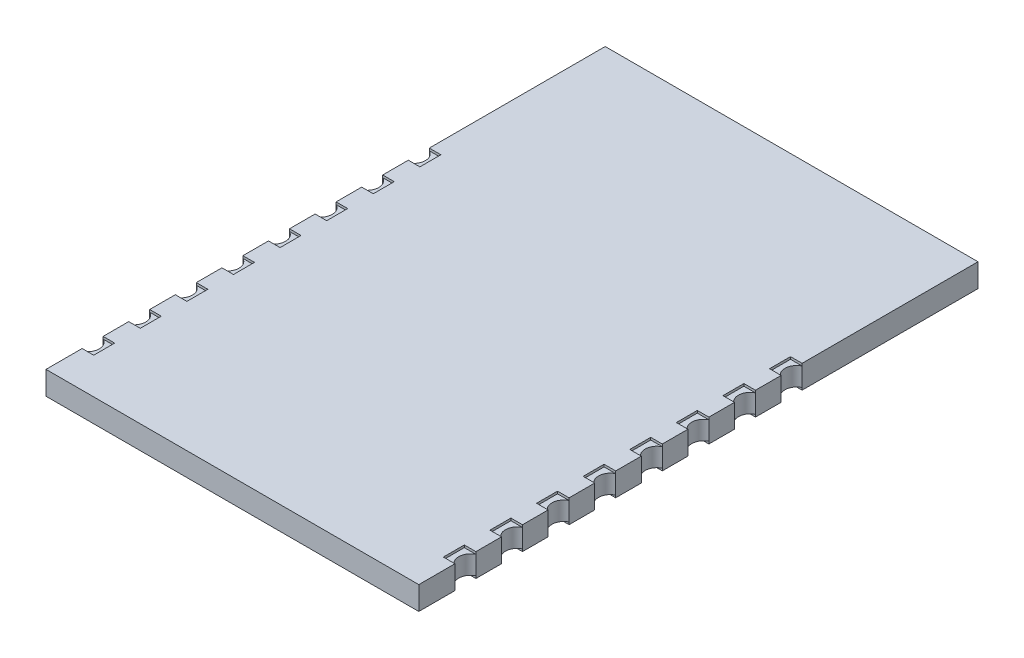
from build123d import *

# Parameters (mm, degrees)
SKETCH_1_W          = 16
SKETCH_1_H          = 24
EXTRUDE_1_DEPTH     = 1
SKETCH_2_W          = 0.497014283
SKETCH_2_H          = 0.9
SKETCH_2_W_2        = 0.5
CUT_EXTRUDE_1_DEPTH = 0.1
SKETCH_3_W          = 1
SKETCH_3_H          = 0.9
CUT_EXTRUDE_2_DEPTH = 0.1
SKETCH_8_W          = 4.7
SKETCH_8_H          = 4.7
CUT_EXTRUDE_3_DEPTH = 0.1
SKETCH_12_R         = 0.2
CUT_EXTRUDE_4_DEPTH = 0.1
SKETCH_13_W         = 4.7
SKETCH_13_H         = 4.7
EXTRUDE_2_DEPTH     = 0.5
SKETCH_15_W         = 4.7
SKETCH_15_H         = 4.7
CUT_EXTRUDE_5_DEPTH = 0.1
SKETCH_16_R         = 0.2
CUT_EXTRUDE_6_DEPTH = 0.25
CUT_EXTRUDE_7_DEPTH = 10


with BuildPart() as part:
    # 草圖1 → 填料-伸長1 (new body)
    with BuildSketch(Plane(origin=(0, 0, 0), x_dir=(1, 0, 0), z_dir=(0, 1, 0))):
        Rectangle(SKETCH_1_W, SKETCH_1_H)
    extrude(amount=EXTRUDE_1_DEPTH)

    # 草圖2 → 除料-伸長1 (cut)
    with BuildSketch(Plane(origin=(0, 1, 0), x_dir=(1, 0, 0), z_dir=(0, 1, 0))):
        with Locations((-7.751492859, 1.999997771)):
            Rectangle(SKETCH_2_W, SKETCH_2_H)
        with Locations((-7.751492859, -2.229e-06)):
            Rectangle(SKETCH_2_W, SKETCH_2_H)
        with Locations((-7.751492859, -2.000002229)):
            Rectangle(SKETCH_2_W, SKETCH_2_H)
        with Locations((-7.751492859, -4.000002229)):
            Rectangle(SKETCH_2_W, SKETCH_2_H)
        with Locations((-7.751492859, -6.000002229)):
            Rectangle(SKETCH_2_W, SKETCH_2_H)
        with Locations((-7.751492859, -8.000002229)):
            Rectangle(SKETCH_2_W, SKETCH_2_H)
        with Locations((-7.751492859, -10.000002229)):
            Rectangle(SKETCH_2_W, SKETCH_2_H)
        with Locations((7.751492859, -10.000002229)):
            Rectangle(SKETCH_2_W, SKETCH_2_H)
        with Locations((7.751492859, -8.000002229)):
            Rectangle(SKETCH_2_W, SKETCH_2_H)
        with Locations((7.751492859, -6.000002229)):
            Rectangle(SKETCH_2_W, SKETCH_2_H)
        with Locations((7.751492859, -4.000002229)):
            Rectangle(SKETCH_2_W, SKETCH_2_H)
        with Locations((7.751492859, -2.000002229)):
            Rectangle(SKETCH_2_W, SKETCH_2_H)
        with Locations((7.751492859, -2.229e-06)):
            Rectangle(SKETCH_2_W, SKETCH_2_H)
        with Locations((7.751492859, 3.999997771)):
            Rectangle(SKETCH_2_W, SKETCH_2_H)
        with Locations((7.751492859, 1.999997771)):
            Rectangle(SKETCH_2_W, SKETCH_2_H)
        with Locations((-7.752985717, 3.999997771)):
            Rectangle(SKETCH_2_W_2, SKETCH_2_H)
    extrude(amount=-CUT_EXTRUDE_1_DEPTH, mode=Mode.SUBTRACT)

    # 草圖3 → 除料-伸長2 (cut)
    with BuildSketch(Plane.XZ):
        with Locations((7.5, 8)):
            Rectangle(SKETCH_3_W, SKETCH_3_H)
        with Locations((7.5, 10)):
            Rectangle(SKETCH_3_W, SKETCH_3_H)
        with Locations((7.5, 6)):
            Rectangle(SKETCH_3_W, SKETCH_3_H)
        with Locations((7.5, 4)):
            Rectangle(SKETCH_3_W, SKETCH_3_H)
        with Locations((7.5, 2)):
            Rectangle(SKETCH_3_W, SKETCH_3_H)
        with Locations((7.5, 0)):
            Rectangle(SKETCH_3_W, SKETCH_3_H)
        with Locations((7.5, -2)):
            Rectangle(SKETCH_3_W, SKETCH_3_H)
        with Locations((7.5, -4)):
            Rectangle(SKETCH_3_W, SKETCH_3_H)
        with Locations((-7.5, 10)):
            Rectangle(SKETCH_3_W, SKETCH_3_H)
        with Locations((-7.5, -4)):
            Rectangle(SKETCH_3_W, SKETCH_3_H)
        with Locations((-7.5, -2)):
            Rectangle(SKETCH_3_W, SKETCH_3_H)
        with Locations((-7.5, 0)):
            Rectangle(SKETCH_3_W, SKETCH_3_H)
        with Locations((-7.5, 2)):
            Rectangle(SKETCH_3_W, SKETCH_3_H)
        with Locations((-7.5, 4)):
            Rectangle(SKETCH_3_W, SKETCH_3_H)
        with Locations((-7.5, 6)):
            Rectangle(SKETCH_3_W, SKETCH_3_H)
        with Locations((-7.5, 8)):
            Rectangle(SKETCH_3_W, SKETCH_3_H)
    extrude(amount=-CUT_EXTRUDE_2_DEPTH, mode=Mode.SUBTRACT)

    # 草圖8 → 除料-伸長3 (cut)
    with BuildSketch(Plane(origin=(0, 1, 0), x_dir=(1, 0, 0), z_dir=(0, 1, 0))):
        with Locations((1.35, -1.75)):
            Rectangle(SKETCH_8_W, SKETCH_8_H)
    extrude(amount=-CUT_EXTRUDE_3_DEPTH, mode=Mode.SUBTRACT)

    # 草圖12 → 除料-伸長4 (cut)
    with BuildSketch(Plane(origin=(0, 0.9, 0), x_dir=(1, 0, 0), z_dir=(0, 1, 0))):
        with Locations(Location((-0.51, -3.65, 0), (0, 0, 270))):
            Circle(SKETCH_12_R)
        with Locations(Location((0.42, -3.65, 0), (0, 0, 270))):
            Circle(SKETCH_12_R)
        with Locations(Location((1.35, -3.65, 0), (0, 0, 270))):
            Circle(SKETCH_12_R)
        with Locations(Location((2.28, -3.65, 0), (0, 0, 270))):
            Circle(SKETCH_12_R)
        with Locations(Location((3.21, -3.65, 0), (0, 0, 270))):
            Circle(SKETCH_12_R)
        with Locations(Location((-0.51, -2.72, 0), (0, 0, 270))):
            Circle(SKETCH_12_R)
        with Locations(Location((0.42, -2.72, 0), (0, 0, 270))):
            Circle(SKETCH_12_R)
        with Locations(Location((1.35, -2.72, 0), (0, 0, 270))):
            Circle(SKETCH_12_R)
        with Locations(Location((2.28, -2.72, 0), (0, 0, 270))):
            Circle(SKETCH_12_R)
        with Locations(Location((3.21, -2.72, 0), (0, 0, 270))):
            Circle(SKETCH_12_R)
        with Locations(Location((-0.51, -1.79, 0), (0, 0, 270))):
            Circle(SKETCH_12_R)
        with Locations(Location((0.42, -1.79, 0), (0, 0, 270))):
            Circle(SKETCH_12_R)
        with Locations(Location((1.35, -1.79, 0), (0, 0, 270))):
            Circle(SKETCH_12_R)
        with Locations(Location((2.28, -1.79, 0), (0, 0, 270))):
            Circle(SKETCH_12_R)
        with Locations(Location((3.21, -1.79, 0), (0, 0, 270))):
            Circle(SKETCH_12_R)
        with Locations(Location((-0.51, -0.86, 0), (0, 0, 270))):
            Circle(SKETCH_12_R)
        with Locations(Location((0.42, -0.86, 0), (0, 0, 270))):
            Circle(SKETCH_12_R)
        with Locations(Location((1.35, -0.86, 0), (0, 0, 270))):
            Circle(SKETCH_12_R)
        with Locations(Location((2.28, -0.86, 0), (0, 0, 270))):
            Circle(SKETCH_12_R)
        with Locations(Location((3.21, -0.86, 0), (0, 0, 270))):
            Circle(SKETCH_12_R)
        with Locations(Location((-0.51, 0.07, 0), (0, 0, 270))):
            Circle(SKETCH_12_R)
        with Locations(Location((0.42, 0.07, 0), (0, 0, 270))):
            Circle(SKETCH_12_R)
        with Locations(Location((1.35, 0.07, 0), (0, 0, 270))):
            Circle(SKETCH_12_R)
        with Locations(Location((2.28, 0.07, 0), (0, 0, 270))):
            Circle(SKETCH_12_R)
        with Locations(Location((3.21, 0.07, 0), (0, 0, 270))):
            Circle(SKETCH_12_R)
    extrude(amount=-CUT_EXTRUDE_4_DEPTH, mode=Mode.SUBTRACT)

    # 草圖13 → 填料-伸長2 (add)
    with BuildSketch(Plane(origin=(0, 1, 0), x_dir=(1, 0, 0), z_dir=(0, 1, 0))):
        with Locations((1.35, -1.75)):
            Rectangle(SKETCH_13_W, SKETCH_13_H)
    extrude(amount=-EXTRUDE_2_DEPTH)

    # 草圖15 → 除料-伸長5 (cut)
    with BuildSketch(Plane.XZ):
        with Locations((-1.35, 1.75)):
            Rectangle(SKETCH_15_W, SKETCH_15_H)
    extrude(amount=-CUT_EXTRUDE_5_DEPTH, mode=Mode.SUBTRACT)

    # 草圖16 → 除料-伸長6 (cut)
    with BuildSketch(Plane.XZ):
        with Locations(Location((0.51, 3.61, 0), (0, 0, 270))):
            Circle(SKETCH_16_R)
        with Locations(Location((-0.42, 3.61, 0), (0, 0, 270))):
            Circle(SKETCH_16_R)
        with Locations(Location((-1.35, 3.61, 0), (0, 0, 270))):
            Circle(SKETCH_16_R)
        with Locations(Location((-2.28, 3.61, 0), (0, 0, 270))):
            Circle(SKETCH_16_R)
        with Locations(Location((-3.21, 3.61, 0), (0, 0, 270))):
            Circle(SKETCH_16_R)
        with Locations(Location((-3.21, 2.68, 0), (0, 0, 270))):
            Circle(SKETCH_16_R)
        with Locations(Location((-2.28, 2.68, 0), (0, 0, 270))):
            Circle(SKETCH_16_R)
        with Locations(Location((-1.35, 2.68, 0), (0, 0, 270))):
            Circle(SKETCH_16_R)
        with Locations(Location((-0.42, 2.68, 0), (0, 0, 270))):
            Circle(SKETCH_16_R)
        with Locations(Location((0.51, 2.68, 0), (0, 0, 270))):
            Circle(SKETCH_16_R)
        with Locations(Location((-3.21, 1.75, 0), (0, 0, 270))):
            Circle(SKETCH_16_R)
        with Locations(Location((-2.28, 1.75, 0), (0, 0, 270))):
            Circle(SKETCH_16_R)
        with Locations(Location((-1.35, 1.75, 0), (0, 0, 270))):
            Circle(SKETCH_16_R)
        with Locations(Location((-0.42, 1.75, 0), (0, 0, 270))):
            Circle(SKETCH_16_R)
        with Locations(Location((0.51, 1.75, 0), (0, 0, 270))):
            Circle(SKETCH_16_R)
        with Locations(Location((-3.21, 0.82, 0), (0, 0, 270))):
            Circle(SKETCH_16_R)
        with Locations(Location((-2.28, 0.82, 0), (0, 0, 270))):
            Circle(SKETCH_16_R)
        with Locations(Location((-1.35, 0.82, 0), (0, 0, 270))):
            Circle(SKETCH_16_R)
        with Locations(Location((-0.42, 0.82, 0), (0, 0, 270))):
            Circle(SKETCH_16_R)
        with Locations(Location((0.51, 0.82, 0), (0, 0, 270))):
            Circle(SKETCH_16_R)
        with Locations(Location((-3.21, -0.11, 0), (0, 0, 270))):
            Circle(SKETCH_16_R)
        with Locations(Location((-2.28, -0.11, 0), (0, 0, 270))):
            Circle(SKETCH_16_R)
        with Locations(Location((-1.35, -0.11, 0), (0, 0, 270))):
            Circle(SKETCH_16_R)
        with Locations(Location((-0.42, -0.11, 0), (0, 0, 270))):
            Circle(SKETCH_16_R)
        with Locations(Location((0.51, -0.11, 0), (0, 0, 270))):
            Circle(SKETCH_16_R)
    extrude(amount=-CUT_EXTRUDE_6_DEPTH, mode=Mode.SUBTRACT)

    # 草圖17 → 除料-伸長7 (cut)
    with BuildSketch(Plane(origin=(0, 1, 0), x_dir=(1, 0, 0), z_dir=(0, 1, 0))):
        with BuildLine():
            Line((-8, 4.449997771), (-8, 3.549997771))
            ThreePointArc((-8, 3.549997771), (-7.717944947, 3.999997771), (-8, 4.449997771))
        make_face()
        with BuildLine():
            Line((-8, 2.449997771), (-8, 1.549997771))
            ThreePointArc((-8, 1.549997771), (-7.717944947, 1.999997771), (-8, 2.449997771))
        make_face()
        with BuildLine():
            Line((-8, 0.449997771), (-8, -0.450002229))
            ThreePointArc((-8, -0.450002229), (-7.717944947, -2.229e-06), (-8, 0.449997771))
        make_face()
        with BuildLine():
            Line((-8, -1.550002229), (-8, -2.450002229))
            ThreePointArc((-8, -2.450002229), (-7.717944947, -2.000002229), (-8, -1.550002229))
        make_face()
        with BuildLine():
            Line((-8, -3.550002229), (-8, -4.450002229))
            ThreePointArc((-8, -4.450002229), (-7.717944947, -4.000002229), (-8, -3.550002229))
        make_face()
        with BuildLine():
            Line((-8, -5.550002229), (-8, -6.450002229))
            ThreePointArc((-8, -6.450002229), (-7.717944947, -6.000002229), (-8, -5.550002229))
        make_face()
        with BuildLine():
            Line((-8, -7.550002229), (-8, -8.450002229))
            ThreePointArc((-8, -8.450002229), (-7.717944947, -8.000002229), (-8, -7.550002229))
        make_face()
        with BuildLine():
            Line((-8, -9.550002229), (-8, -10.450002229))
            ThreePointArc((-8, -10.450002229), (-7.717944947, -10.000002229), (-8, -9.550002229))
        make_face()
        with BuildLine():
            Line((8, -9.550002229), (8, -10.450002229))
            ThreePointArc((8, -10.450002229), (7.717944947, -10.000002229), (8, -9.550002229))
        make_face()
        with BuildLine():
            Line((8, -7.550002229), (8, -8.450002229))
            ThreePointArc((8, -8.450002229), (7.717944947, -8.000002229), (8, -7.550002229))
        make_face()
        with BuildLine():
            Line((8, -5.550002229), (8, -6.450002229))
            ThreePointArc((8, -6.450002229), (7.717944947, -6.000002229), (8, -5.550002229))
        make_face()
        with BuildLine():
            Line((8, -3.550002229), (8, -4.450002229))
            ThreePointArc((8, -4.450002229), (7.717944947, -4.000002229), (8, -3.550002229))
        make_face()
        with BuildLine():
            Line((8, -1.550002229), (8, -2.450002229))
            ThreePointArc((8, -2.450002229), (7.717944947, -2.000002229), (8, -1.550002229))
        make_face()
        with BuildLine():
            Line((8, 0.449997771), (8, -0.450002229))
            ThreePointArc((8, -0.450002229), (7.717944947, -2.229e-06), (8, 0.449997771))
        make_face()
        with BuildLine():
            Line((8, 2.449997771), (8, 1.549997771))
            ThreePointArc((8, 1.549997771), (7.717944947, 1.999997771), (8, 2.449997771))
        make_face()
        with BuildLine():
            Line((8, 4.449997771), (8, 3.549997771))
            ThreePointArc((8, 3.549997771), (7.717944947, 3.999997771), (8, 4.449997771))
        make_face()
    extrude(amount=-CUT_EXTRUDE_7_DEPTH, mode=Mode.SUBTRACT)


solid = part.part
